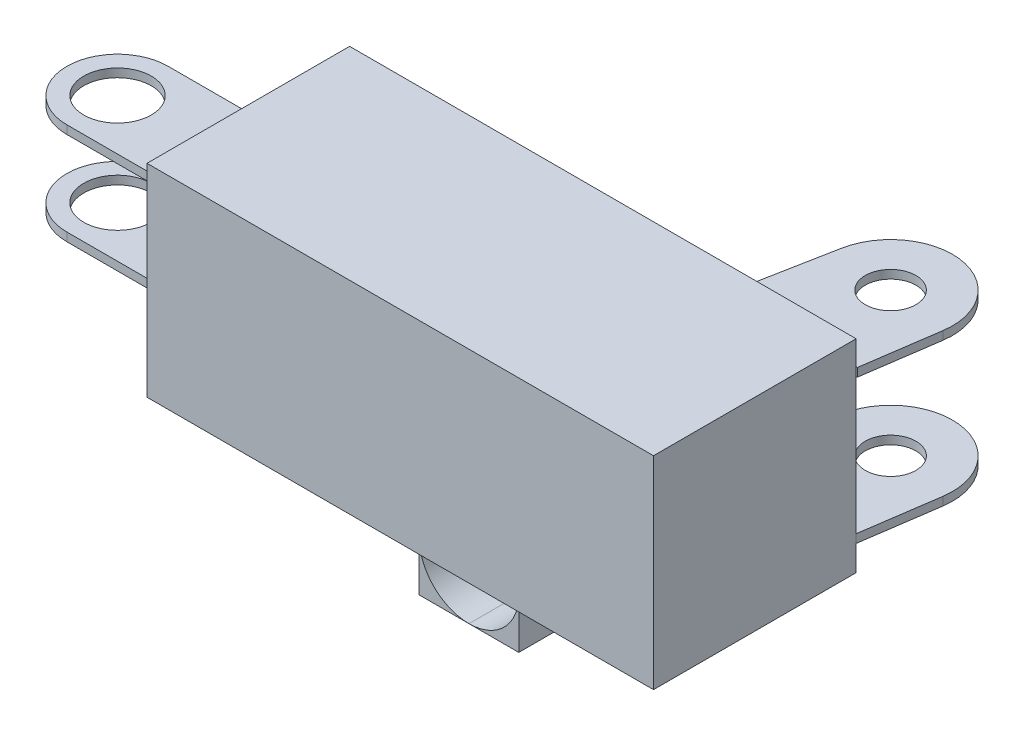
from build123d import *

# Parameters (mm, degrees)
SKETCH_1_W          = 300
SKETCH_1_H          = 120
EXTRUDE_1_DEPTH     = 120
SKETCH_4_R          = 15
EXTRUDE_2_DEPTH     = 5
SKETCH_8_R          = 15
EXTRUDE_3_DEPTH     = 5
SKETCH_9_W          = 60
SKETCH_9_H          = 60
EXTRUDE_4_DEPTH     = 10
SKETCH_10_R         = 20
EXTRUDE_6_DEPTH     = 5
EXTRUDE_START       = -5
SKETCH_11_R         = 20
EXTRUDE_7_DEPTH     = 5
SKETCH_12_W         = 59
SKETCH_12_H         = 59
EXTRUDE_8_DEPTH     = 59
SKETCH_13_R         = 29.5
CUT_EXTRUDE_2_DEPTH = 59


with BuildPart() as part:
    # 草图1 → 凸台-拉伸1 (new body)
    with BuildSketch(Plane.XY):
        Rectangle(SKETCH_1_W, SKETCH_1_H)
    extrude(amount=EXTRUDE_1_DEPTH)

    # 草图4 → 凸台-拉伸2 (add)
    with BuildSketch(Plane(origin=(0, -45, 0), x_dir=(-1, 0, 0), z_dir=(0, -1, 0))):
        with BuildLine():
            Line((-156.527175932, 44.910966087), (-150, 0))
            Line((-150, 0), (-73.31889354, 0))
            Line((-73.31889354, 0), (-84.21897449, 57.065129679))
            ThreePointArc((-84.21897449, 57.065129679), (-126.316684667, 86.348087805), (-156.527175932, 44.910966087))
        make_face()
        with Locations(Location((-120.238104214, 50.185071192, 0), (0, 0, 90))):
            Circle(SKETCH_4_R, mode=Mode.SUBTRACT)
    extrude(amount=-EXTRUDE_2_DEPTH)

    # 草图9 → 凸台-拉伸4 (add)
    with BuildSketch(Plane.ZY.offset(150)):
        with Locations((63.976226304, 0)):
            Rectangle(SKETCH_9_W, SKETCH_9_H)
    extrude(amount=EXTRUDE_4_DEPTH)

    # 草图10 → 凸台-拉伸6 (add)
    with BuildSketch(Plane.XZ.offset(30)):
        with BuildLine():
            ThreePointArc((-223.493282039, 33.976226304), (-253.493282039, 63.976226304), (-223.493282039, 93.976226304))
            Line((-223.493282039, 93.976226304), (-160, 93.976226304))
            Line((-160, 93.976226304), (-160, 33.976226304))
            Line((-160, 33.976226304), (-223.493282039, 33.976226304))
        make_face()
        with Locations(Location((-223.493282039, 63.976226304, 0), (0, 0, 270))):
            Circle(SKETCH_10_R, mode=Mode.SUBTRACT)
    extrude(amount=-EXTRUDE_6_DEPTH)

    # 草图11 → 凸台-拉伸7 (add)
    with BuildSketch(Plane(origin=(0, 30, 0), x_dir=(1, 0, 0), z_dir=(0, 1, 0)).offset(EXTRUDE_START)):
        with BuildLine():
            Line((-223.493282039, -33.976226304), (-160, -33.976226304))
            Line((-160, -33.976226304), (-160, -93.976226304))
            Line((-160, -93.976226304), (-223.493282039, -93.976226304))
            ThreePointArc((-223.493282039, -93.976226304), (-253.493282039, -63.976226304), (-223.493282039, -33.976226304))
        make_face()
        with Locations(Location((-223.493282039, -63.976226304, 0), (0, 0, 90))):
            Circle(SKETCH_11_R, mode=Mode.SUBTRACT)
    extrude(amount=EXTRUDE_7_DEPTH)

    # 草图12 → 凸台-拉伸8 (add)
    with BuildSketch(Plane.XZ.offset(60)):
        with Locations((2.49896869, 52.292933775)):
            Rectangle(SKETCH_12_W, SKETCH_12_H)
    extrude(amount=EXTRUDE_8_DEPTH)

    # 草图13 → 切除-拉伸2 (cut)
    with BuildSketch(Plane.XY.offset(81.792933775)):
        with Locations((2.49896869, -89.5)):
            Circle(SKETCH_13_R)
    extrude(amount=-CUT_EXTRUDE_2_DEPTH, mode=Mode.SUBTRACT)


with BuildPart() as body_2:
    # 草图8 → 凸台-拉伸3 (new body)
    with BuildSketch(Plane(origin=(0, 45, 0), x_dir=(1, 0, 0), z_dir=(0, 1, 0))):
        with BuildLine():
            Line((84.21897449, 57.065129679), (73.31889354, 0))
            Line((73.31889354, 0), (150.100867109, 0.694027454))
            Line((150.100867109, 0.694027454), (156.527175932, 44.910966087))
            ThreePointArc((156.527175932, 44.910966087), (126.316684667, 86.348087805), (84.21897449, 57.065129679))
        make_face()
        with Locations(Location((120.238104214, 50.185071192, 0), (0, 0, 270))):
            Circle(SKETCH_8_R, mode=Mode.SUBTRACT)
    extrude(amount=-EXTRUDE_3_DEPTH)


with BuildPart() as cut_extrude_2_piece_1:
    # of the separate pieces the step leaves, piece 1, a body of its own (cut_extrude_2_pieces)
    add(part.part.solids().sort_by_distance((-150, -60, 0))[0])


with BuildPart() as cut_extrude_2_piece_2:
    # of the separate pieces the step leaves, piece 2, a body of its own (cut_extrude_2_pieces)
    add(part.part.solids().sort_by_distance((-27.00103131, -119, 22.792933775))[0])


with BuildPart() as cut_extrude_2_piece_3:
    # of the separate pieces the step leaves, piece 3, a body of its own (cut_extrude_2_pieces)
    add(part.part.solids().sort_by_distance((31.99896869, -119, 81.792933775))[0])


solid = Compound([body_2.part, cut_extrude_2_piece_1.part, cut_extrude_2_piece_2.part, cut_extrude_2_piece_3.part])
